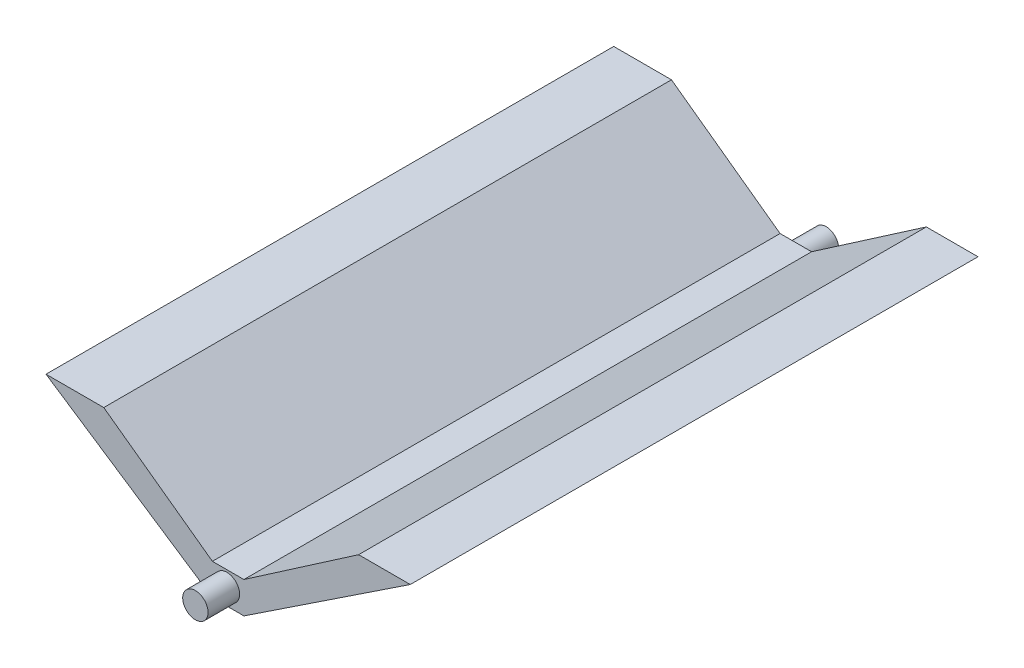
from build123d import *

# Parameters (mm, degrees)
BOSS_EXTRUDE1_DEPTH = 360
CUT_EXTRUDE1_DEPTH  = 360
SKETCH3_R           = 8.05
BOSS_EXTRUDE2_DEPTH = 20
SKETCH4_R           = 7.873776935
BOSS_EXTRUDE3_DEPTH = 20


with BuildPart() as part:
    # Sketch1 → Boss-Extrude1 (new body)
    with BuildSketch(Plane.XY):
        Polygon((-115.5, 32.593599034), (-10, -37.406400966), (10, -37.406400966), (115.5, 32.593599034), align=None)
    extrude(amount=BOSS_EXTRUDE1_DEPTH)

    # Sketch2 → Cut-Extrude1 (cut)
    with BuildSketch(Plane.XY.offset(360)):
        Polygon((-78.867089656, 32.593599034), (82.733123463, 32.593599034), (10, -17.406400966), (-10, -17.406400966), align=None)
    extrude(amount=-CUT_EXTRUDE1_DEPTH, mode=Mode.SUBTRACT)

    # Sketch3 → Boss-Extrude2 (add)
    with BuildSketch(Plane.XY.offset(360)):
        with Locations((-0.773206761, -26.891281742)):
            Circle(SKETCH3_R)
    extrude(amount=BOSS_EXTRUDE2_DEPTH)

    # Sketch4 → Boss-Extrude3 (add)
    with BuildSketch(Plane(origin=(0, 0, 0), x_dir=(-1, 0, 0), z_dir=(0, 0, -1))):
        with Locations(Location((0.773206761, -26.891281742, 0), (0, 0, 180))):
            Circle(SKETCH4_R)
    extrude(amount=BOSS_EXTRUDE3_DEPTH)


solid = part.part
